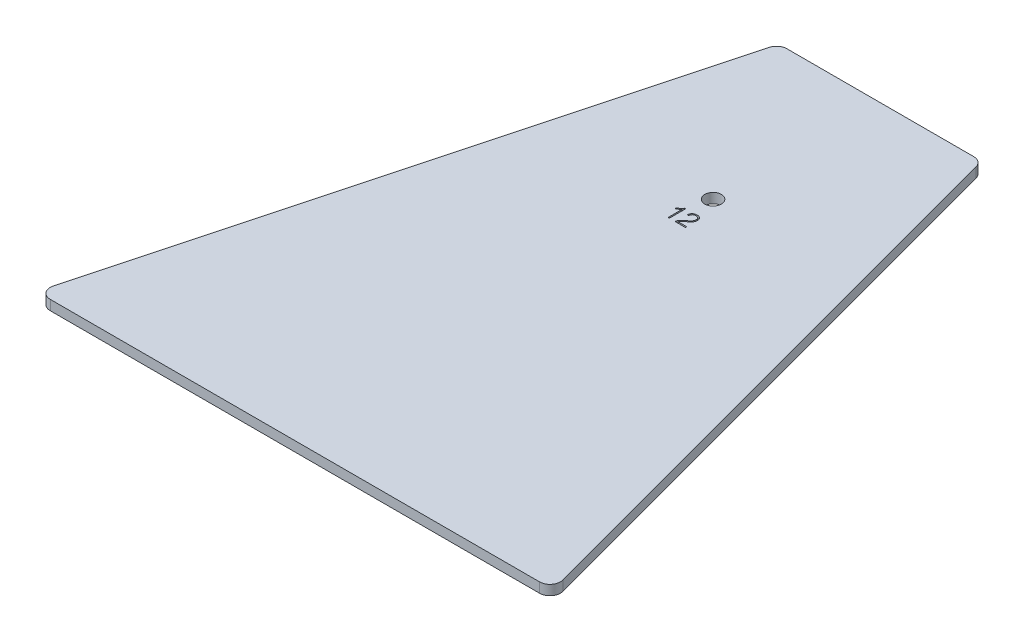
from build123d import *

# Parameters (mm, degrees)
BOSS_EXTRUDE1_DEPTH = 5.9944
SKETCH2_R           = 5.08
CUT_EXTRUDE1_DEPTH  = 390.227437664
CUT_EXTRUDE2_DEPTH  = 1.27
FILLET1_R           = 6.35


with BuildPart() as part:
    # Sketch1 → Boss-Extrude1 (new body)
    with BuildSketch(Plane(origin=(0, 0, 0), x_dir=(1, 0, 0), z_dir=(0, 1, 0))):
        Polygon((-60.325, 0), (62.865, 0), (158.147732829, -355.6), (-155.607732829, -355.6), align=None)
    extrude(amount=BOSS_EXTRUDE1_DEPTH)

    # Sketch2 → Cut-Extrude1 (cut, through all)
    with BuildSketch(Plane(origin=(0, 5.9944, 0), x_dir=(1, 0, 0), z_dir=(0, 1, 0))):
        with Locations(Location((1.27, -101.6, 0), (0, 0, 270))):
            Circle(SKETCH2_R)
    extrude(amount=-CUT_EXTRUDE1_DEPTH, mode=Mode.SUBTRACT)

    # Sketch3 → Cut-Extrude2 (cut)
    with BuildSketch(Plane(origin=(0, 5.9944, 0), x_dir=(1, 0, 0), z_dir=(0, 1, 0))):
        with BuildLine():
            Line((-2.004607843, -124.878144621), (-2.801470588, -124.878144621))
            Line((-2.801470588, -124.878144621), (-2.801470588, -116.532875013))
            add(Edge.make_bspline(
                [(-2.801470588, -116.532875013), (-2.997580196, -116.700819797), (-3.386189924, -117.033618267), (-4.021446732, -117.460305556), (-4.686888668, -117.826576867), (-5.156638111, -118.012129239), (-5.39127451, -118.104811287)],
                knots=[0, 0, 0, 0, 1.01587232, 2.013047047, 3.007531584, 4, 4, 4, 4], degree=3))
            Line((-5.39127451, -118.104811287), (-5.39127451, -117.307948542))
            add(Edge.make_bspline(
                [(-5.39127451, -117.307948542), (-5.215920906, -117.217505842), (-4.877167455, -117.042785871), (-4.403316888, -116.758839494), (-3.978244692, -116.470049726), (-3.602949198, -116.17444242), (-3.276786637, -115.872526552), (-3.001240232, -115.563383013), (-2.771725814, -115.249055295), (-2.657674184, -115.025829059), (-2.602254902, -114.917360307)],
                knots=[0, 0, 0, 0, 1.266365021, 2.446402654, 3.543839948, 4.563310278, 5.51059178, 6.392882026, 7.219078889, 8, 8, 8, 8], degree=3))
            Line((-2.602254902, -114.917360307), (-2.004607843, -114.917360307))
            Line((-2.004607843, -114.917360307), (-2.004607843, -124.878144621))
        make_face()
        with BuildLine():
            Line((7.756960784, -124.878144621), (1.382058824, -124.878144621))
            add(Edge.make_bspline(
                [(1.382058824, -124.878144621), (1.408711728, -124.714616011), (1.461765394, -124.389105805), (1.581972244, -123.981996467), (1.743426669, -123.650686593), (1.9293472, -123.370987394), (2.168929241, -123.057519518), (2.47120082, -122.71410621), (2.835292405, -122.341606598), (3.26682725, -121.943231351), (3.76528863, -121.520849044), (4.12547647, -121.238121937), (4.314264706, -121.089933836)],
                knots=[0, 0, 0, 0, 1.00794059, 2.006345856, 2.568221262, 3.244176762, 4.045978883, 4.967707078, 6.025786227, 7.214078669, 8.539791974, 10, 10, 10, 10], degree=3))
            add(Edge.make_bspline(
                [(4.314264706, -121.089933836), (4.44517426, -120.987435642), (4.692315869, -120.79393129), (5.03663113, -120.518956984), (5.330891728, -120.274531461), (5.654603916, -119.998078646), (6.00245485, -119.669813627), (6.353952481, -119.268109359), (6.634490533, -118.868145818), (6.82961898, -118.465238329), (6.941715143, -118.053908101), (6.953924697, -117.775536057), (6.960098039, -117.634786777)],
                knots=[0, 0, 0, 0, 1.105083233, 2.086265203, 2.928643677, 3.647492745, 4.915719202, 6.103603942, 7.190110835, 8.152548768, 9.065899631, 10, 10, 10, 10], degree=3))
            add(Edge.make_bspline(
                [(6.960098039, -117.634786777), (6.956446087, -117.531840775), (6.949349268, -117.331786414), (6.896203587, -117.042256181), (6.805514931, -116.774954845), (6.678536736, -116.530021827), (6.524513793, -116.305351489), (6.336809674, -116.107371083), (6.124267579, -115.931524187), (5.883239638, -115.782669248), (5.619825862, -115.659684087), (5.331783261, -115.577707036), (5.025139044, -115.521422364), (4.812576912, -115.517184746), (4.703357843, -115.515007366)],
                knots=[0, 0, 0, 0, 1.066440105, 2.072406788, 3.038089023, 3.980626898, 4.923164774, 5.851240192, 6.79842777, 7.774055624, 8.779619978, 9.800248095, 10.869719403, 12, 12, 12, 12], degree=3))
            add(Edge.make_bspline(
                [(4.703357843, -115.515007366), (4.548138853, -115.520928959), (4.250554949, -115.532281765), (3.828569287, -115.636647969), (3.455686954, -115.810346784), (3.131253079, -116.053703201), (2.863324958, -116.371844332), (2.643875434, -116.754056503), (2.47967465, -117.206553497), (2.413141707, -117.534067539), (2.378137255, -117.706379915)],
                knots=[0, 0, 0, 0, 1.052503955, 2.0178474, 2.928593632, 3.828899676, 4.748107049, 5.732867451, 6.807211463, 8, 8, 8, 8], degree=3))
            Line((2.378137255, -117.706379915), (1.58127451, -117.581870111))
            add(Edge.make_bspline(
                [(1.58127451, -117.581870111), (1.595076615, -117.472635137), (1.622075599, -117.258955176), (1.691468745, -116.949821561), (1.781188383, -116.65900971), (1.894180859, -116.386211747), (2.027180985, -116.131787712), (2.181450374, -115.894298832), (2.359285462, -115.67667965), (2.558282869, -115.477221584), (2.777101916, -115.300105787), (3.010614318, -115.143004122), (3.261947111, -115.012623851), (3.527029837, -114.902576084), (3.808744154, -114.818752319), (4.105725503, -114.759825606), (4.418264758, -114.725756279), (4.631681691, -114.72071836), (4.740710784, -114.718144621)],
                knots=[0, 0, 0, 0, 1.11558569, 2.182252598, 3.206865404, 4.197163727, 5.171016007, 6.113287932, 7.062752653, 8.014719109, 8.96418383, 9.912249364, 10.862587531, 11.829428462, 12.817713982, 13.836697005, 14.894825442, 16, 16, 16, 16], degree=3))
            add(Edge.make_bspline(
                [(4.740710784, -114.718144621), (4.847691173, -114.72046441), (5.058171976, -114.725028527), (5.36652187, -114.763086832), (5.660393604, -114.82495492), (5.939114933, -114.911807601), (6.20152099, -115.026029366), (6.453209418, -115.158232899), (6.686929332, -115.3230483), (6.90677244, -115.507442597), (7.10466303, -115.712898212), (7.281765919, -115.930826025), (7.427856103, -116.167038419), (7.551242282, -116.415109275), (7.639716311, -116.6810721), (7.709539512, -116.957384709), (7.75083418, -117.249641754), (7.754889172, -117.448930261), (7.756960784, -117.55074266)],
                knots=[0, 0, 0, 0, 1.106681904, 2.177364475, 3.209175827, 4.210887483, 5.192078542, 6.167200624, 7.147039734, 8.145062256, 9.132109826, 10.094560107, 11.044836899, 12.000375742, 12.954465884, 13.938765234, 14.946957558, 16, 16, 16, 16], degree=3))
            add(Edge.make_bspline(
                [(7.756960784, -117.55074266), (7.753392459, -117.673373377), (7.746338565, -117.915790814), (7.689282598, -118.27439108), (7.590587318, -118.620687231), (7.461036956, -118.958802553), (7.290519429, -119.282309345), (7.09006167, -119.596153204), (6.8567572, -119.897227952), (6.634069689, -120.13817633), (6.430892234, -120.330451922), (6.256380071, -120.493260828), (6.057657341, -120.670326555), (5.833743473, -120.859320414), (5.585765126, -121.061219336), (5.319829881, -121.283578823), (5.026752033, -121.516537042), (4.821857186, -121.674370634), (4.715808824, -121.756061287)],
                knots=[0, 0, 0, 0, 1.088993338, 2.152731221, 3.214950677, 4.282992305, 5.363056107, 6.45734114, 7.587448717, 8.741912054, 9.367708333, 10.072059012, 10.861970471, 11.731730561, 12.674646287, 13.702521352, 14.810883478, 16, 16, 16, 16], degree=3))
            add(Edge.make_bspline(
                [(4.715808824, -121.756061287), (4.589531577, -121.855817691), (4.343139397, -122.050462401), (3.994847151, -122.350096885), (3.673432745, -122.643330902), (3.386447313, -122.938064959), (3.127000006, -123.22720294), (2.897403274, -123.51287463), (2.693792631, -123.79321546), (2.582015901, -123.986901831), (2.52754902, -124.081281875)],
                knots=[0, 0, 0, 0, 1.201760701, 2.344875646, 3.430713183, 4.449969728, 5.415927222, 6.330865599, 7.186659457, 8, 8, 8, 8], degree=3))
            Line((2.52754902, -124.081281875), (7.756960784, -124.081281875))
            Line((7.756960784, -124.081281875), (7.756960784, -124.878144621))
        make_face()
    extrude(amount=-CUT_EXTRUDE2_DEPTH, mode=Mode.SUBTRACT)

    # Fillet1
    fillet1_edges = [part.edges().sort_by_distance(p)[0] for p in [
        (158.147732829, 2.9972, 355.6),
        (-155.607732829, 2.9972, 355.6),
        (-60.325, 2.9972, 0),
        (62.865, 2.9972, 0),
    ]]
    fillet(fillet1_edges, radius=FILLET1_R)


solid = part.part
